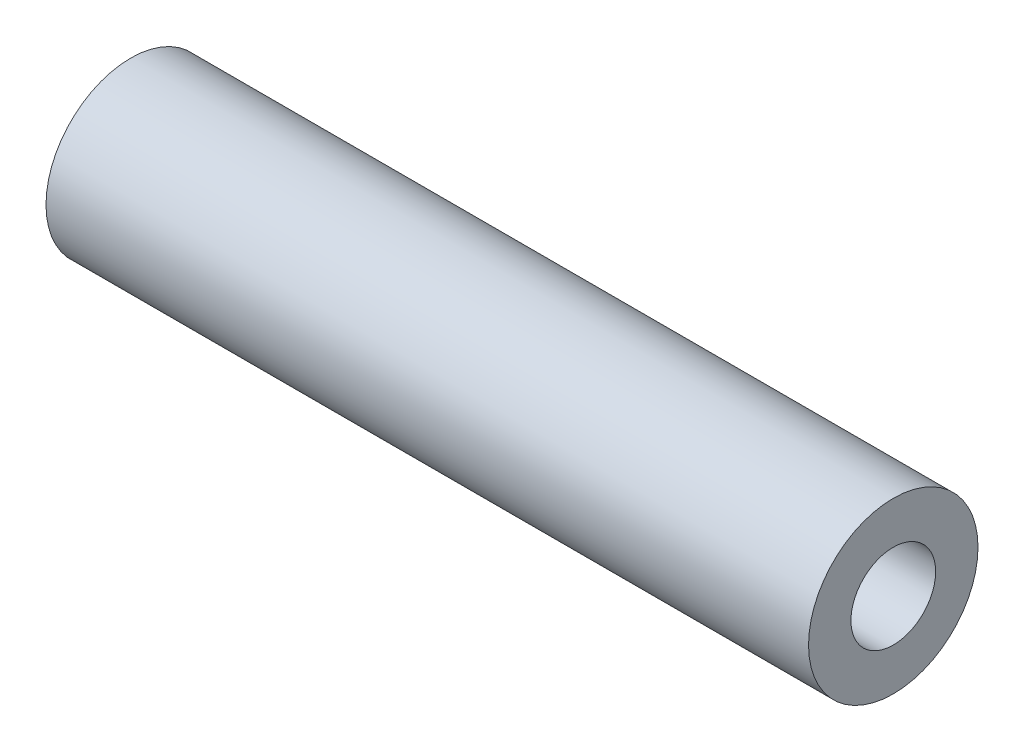
from build123d import *

# Parameters (mm, degrees)
SKETCH1_R           = 12.7
SKETCH1_R_2         = 6.35
BOSS_EXTRUDE1_DEPTH = 114.3


with BuildPart() as part:
    # Sketch1 → Boss-Extrude1 (new body)
    with BuildSketch(Plane(origin=(0, 0, 0), x_dir=(0, 0, -1), z_dir=(1, 0, 0))):
        Circle(SKETCH1_R)
        Circle(SKETCH1_R_2, mode=Mode.SUBTRACT)
    extrude(amount=BOSS_EXTRUDE1_DEPTH)


solid = part.part
